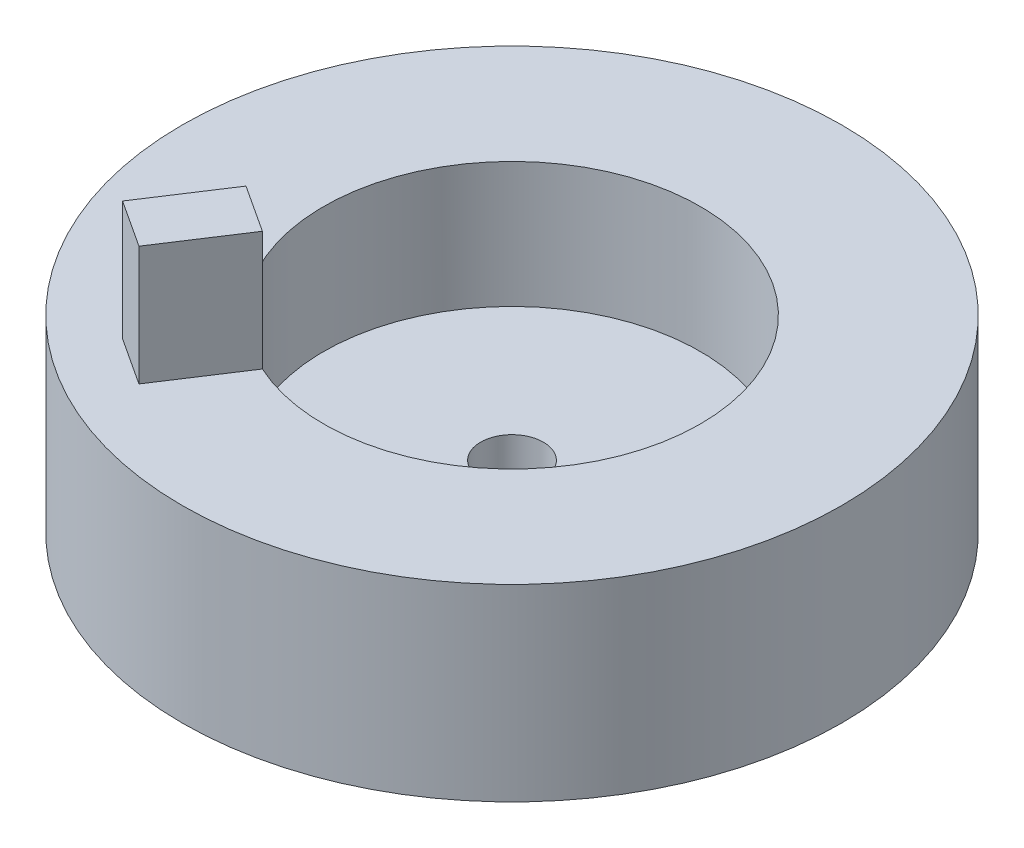
from build123d import *

# Parameters (mm, degrees)
SKIZZE1_R                       = 52.5
SKIZZE1_R_2                     = 30
AUFSATZ_LINEAR_AUSTRAGEN1_DEPTH = 20
AUFSATZ_LINEAR_START            = 10
SKIZZE2_R                       = 52.5
SKIZZE2_R_2                     = 5
AUFSATZ_LINEAR_AUSTRAGEN2_DEPTH = 10
AUFSATZ_LINEAR_AUSTRAGEN3_DEPTH = 19


with BuildPart() as part:
    # Skizze1 → Aufsatz-Linear austragen1 (new body)
    with BuildSketch(Plane(origin=(0, 0, 0), x_dir=(1, 0, 0), z_dir=(0, 1, 0))):
        with Locations(Location((0, 0, 0), (0, 0, 270))):
            Circle(SKIZZE1_R)
        with Locations(Location((0, 0, 0), (0, 0, 270))):
            Circle(SKIZZE1_R_2, mode=Mode.SUBTRACT)
    extrude(amount=AUFSATZ_LINEAR_AUSTRAGEN1_DEPTH)

    # Skizze2 → Aufsatz-Linear austragen2 (add)
    with BuildSketch(Plane.XZ.offset(AUFSATZ_LINEAR_START)):
        with Locations(Location((0, 0, 0), (0, 0, 270))):
            Circle(SKIZZE2_R)
        with Locations(Location((0, 0, 0), (0, 0, 270))):
            Circle(SKIZZE2_R_2, mode=Mode.SUBTRACT)
    extrude(amount=-AUFSATZ_LINEAR_AUSTRAGEN2_DEPTH)

    # Skizze3 → Aufsatz-Linear austragen3 (add)
    with BuildSketch(Plane(origin=(0, 20, 0), x_dir=(1, 0, 0), z_dir=(0, 1, 0))):
        Polygon((-12.455419354, -27.292169732), (-19.989941293, -22.369672485), (-27.756548062, -34.257473767), (-20.222026123, -39.179971014), align=None)
    extrude(amount=AUFSATZ_LINEAR_AUSTRAGEN3_DEPTH)


solid = part.part
